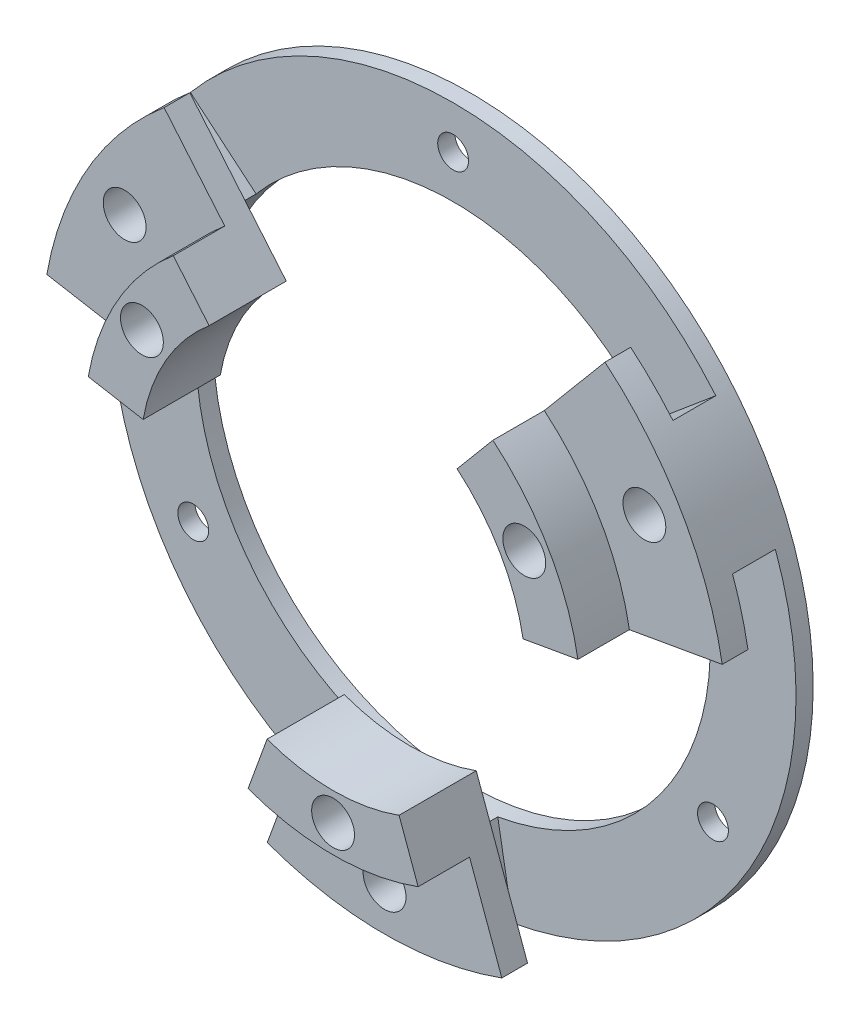
from build123d import *
from build123d.topology import SkipClean

# Parameters (mm, degrees)
SKETCH_1_R          = 40
SKETCH_1_R_2        = 30
EXTRUDE_1_DEPTH     = 2
CUT_EXTRUDE_1_REACH = 58.604
SKETCH_2_R          = 1.8
EXTRUDE_3_DEPTH     = 5
EXTRUDE_4_DEPTH     = 3
CUT_EXTRUDE_2_REACH = 59.446
SKETCH_5_R          = 2.5
EXTRUDE_START       = -3
EXTRUDE_5_DEPTH     = 9
CUT_EXTRUDE_START   = -6
CUT_EXTRUDE_3_DEPTH = 6
CUT_EXTRUDE_4_REACH = 60.788
SKETCH_8_R          = 2.5


with BuildPart() as part:
    # 草图1 → 凸台-拉伸1 (new body)
    with BuildSketch(Plane.XY):
        Circle(SKETCH_1_R)
        Circle(SKETCH_1_R_2, mode=Mode.SUBTRACT)
    extrude(amount=EXTRUDE_1_DEPTH)

    # 草图2 → 切除-拉伸1 (cut, up to next)
    with BuildSketch(Plane.XY.offset(2), mode=Mode.PRIVATE) as cut_extrude_1_sk1:
        with Locations((0, 35)):
            Circle(SKETCH_2_R)
    cut_extrude_1_tool1 = extrude(cut_extrude_1_sk1.sketch, amount=-CUT_EXTRUDE_1_REACH, mode=Mode.PRIVATE) & part.part
    # 草图2 → 切除-拉伸1 (cut, up to next)
    with BuildSketch(Plane.XY.offset(2), mode=Mode.PRIVATE) as cut_extrude_1_sk2:
        with Locations((30.310889132, -17.5)):
            Circle(SKETCH_2_R)
    cut_extrude_1_tool2 = extrude(cut_extrude_1_sk2.sketch, amount=-CUT_EXTRUDE_1_REACH, mode=Mode.PRIVATE) & part.part
    # 草图2 → 切除-拉伸1 (cut, up to next)
    with BuildSketch(Plane.XY.offset(2), mode=Mode.PRIVATE) as cut_extrude_1_sk3:
        with Locations((-30.310889132, -17.5)):
            Circle(SKETCH_2_R)
    cut_extrude_1_tool3 = extrude(cut_extrude_1_sk3.sketch, amount=-CUT_EXTRUDE_1_REACH, mode=Mode.PRIVATE) & part.part
    add(cut_extrude_1_tool1.solids().sort_by_distance((0, 35, 2))[0], mode=Mode.SUBTRACT)
    add(cut_extrude_1_tool2.solids().sort_by_distance((30.310889, -17.5, 2))[0], mode=Mode.SUBTRACT)
    add(cut_extrude_1_tool3.solids().sort_by_distance((-30.310889, -17.5, 2))[0], mode=Mode.SUBTRACT)

    # 草图3 → 凸台-拉伸3 (add)
    with BuildSketch(Plane.XY.offset(2)):
        with BuildLine():
            Line((30.641777725, 25.711504387), (22.981333294, 19.283628291))
            ThreePointArc((22.981333294, 19.283628291), (25.980762114, 15), (28.190778624, 10.2606043))
            Line((28.190778624, 10.2606043), (37.587704831, 13.680805733))
            ThreePointArc((37.587704831, 13.680805733), (34.641016151, 20), (30.641777725, 25.711504387))
        make_face()
        with BuildLine():
            ThreePointArc((-28.190778624, 10.2606043), (-25.980762114, 15), (-22.981333294, 19.283628291))
            Line((-22.981333294, 19.283628291), (-30.641777725, 25.711504387))
            ThreePointArc((-30.641777725, 25.711504387), (-34.641016151, 20), (-37.587704831, 13.680805733))
            Line((-37.587704831, 13.680805733), (-28.190778624, 10.2606043))
        make_face()
        with BuildLine():
            Line((6.945927107, -39.39231012), (5.20944533, -29.54423259))
            ThreePointArc((5.20944533, -29.54423259), (0, -30), (-5.20944533, -29.54423259))
            Line((-5.20944533, -29.54423259), (-6.945927107, -39.39231012))
            ThreePointArc((-6.945927107, -39.39231012), (0, -40), (6.945927107, -39.39231012))
        make_face()
    extrude(amount=EXTRUDE_3_DEPTH)

    # 草图4 → 凸台-拉伸4 (add)
    with BuildSketch(Plane.XY.offset(7)):
        with BuildLine():
            ThreePointArc((-22.981333294, 19.283628291), (-21.213203436, 21.213203436), (-19.283628291, 22.981333294))
            Line((-19.283628291, 22.981333294), (-25.711504387, 30.641777725))
            ThreePointArc((-25.711504387, 30.641777725), (-28.284271247, 28.284271247), (-30.641777725, 25.711504387))
            Line((-30.641777725, 25.711504387), (-22.981333294, 19.283628291))
        make_face()
        with BuildLine():
            ThreePointArc((-25.980762114, 15), (-24.574561329, 17.207293091), (-22.981333294, 19.283628291))
            Line((-22.981333294, 19.283628291), (-30.641777725, 25.711504387))
            ThreePointArc((-30.641777725, 25.711504387), (-32.766081772, 22.943057454), (-34.641016151, 20))
            Line((-34.641016151, 20), (-25.980762114, 15))
        make_face()
        with BuildLine():
            ThreePointArc((-28.190778624, 10.2606043), (-27.189233611, 12.678547852), (-25.980762114, 15))
            Line((-25.980762114, 15), (-34.641016151, 20))
            ThreePointArc((-34.641016151, 20), (-36.252311481, 16.90473047), (-37.587704831, 13.680805733))
            Line((-37.587704831, 13.680805733), (-28.190778624, 10.2606043))
        make_face()
        with BuildLine():
            ThreePointArc((-29.54423259, 5.20944533), (-28.977774789, 7.764571353), (-28.190778624, 10.2606043))
            Line((-28.190778624, 10.2606043), (-37.587704831, 13.680805733))
            ThreePointArc((-37.587704831, 13.680805733), (-38.637033052, 10.352761804), (-39.39231012, 6.945927107))
            Line((-39.39231012, 6.945927107), (-29.54423259, 5.20944533))
        make_face()
        with BuildLine():
            Line((25.711504387, 30.641777725), (19.283628291, 22.981333294))
            ThreePointArc((19.283628291, 22.981333294), (21.213203436, 21.213203436), (22.981333294, 19.283628291))
            ThreePointArc((22.981333294, 19.283628291), (25.980762114, 15), (28.190778624, 10.2606043))
            ThreePointArc((28.190778624, 10.2606043), (28.977774789, 7.764571353), (29.54423259, 5.20944533))
            Line((29.54423259, 5.20944533), (39.39231012, 6.945927107))
            ThreePointArc((39.39231012, 6.945927107), (38.637033052, 10.352761804), (37.587704831, 13.680805733))
            ThreePointArc((37.587704831, 13.680805733), (34.641016151, 20), (30.641777725, 25.711504387))
            ThreePointArc((30.641777725, 25.711504387), (28.284271247, 28.284271247), (25.711504387, 30.641777725))
        make_face()
        with BuildLine():
            ThreePointArc((-5.20944533, -29.54423259), (-7.764571353, -28.977774789), (-10.2606043, -28.190778624))
            Line((-10.2606043, -28.190778624), (-13.680805733, -37.587704831))
            ThreePointArc((-13.680805733, -37.587704831), (-10.352761804, -38.637033052), (-6.945927107, -39.39231012))
            ThreePointArc((-6.945927107, -39.39231012), (0, -40), (6.945927107, -39.39231012))
            ThreePointArc((6.945927107, -39.39231012), (10.352761804, -38.637033052), (13.680805733, -37.587704831))
            Line((13.680805733, -37.587704831), (10.2606043, -28.190778624))
            ThreePointArc((10.2606043, -28.190778624), (7.764571353, -28.977774789), (5.20944533, -29.54423259))
            ThreePointArc((5.20944533, -29.54423259), (0, -30), (-5.20944533, -29.54423259))
        make_face()
    extrude(amount=EXTRUDE_4_DEPTH)

    # 草图5 → 切除-拉伸2 (cut, up to next)
    with BuildSketch(Plane.XY.offset(10), mode=Mode.PRIVATE) as cut_extrude_2_sk1:
        with Locations((-30.310889132, 17.5)):
            Circle(SKETCH_5_R)
    cut_extrude_2_tool1 = extrude(cut_extrude_2_sk1.sketch, amount=-CUT_EXTRUDE_2_REACH, mode=Mode.PRIVATE) & part.part
    # 草图5 → 切除-拉伸2 (cut, up to next)
    with BuildSketch(Plane.XY.offset(10), mode=Mode.PRIVATE) as cut_extrude_2_sk2:
        with Locations((30.310889132, 17.5)):
            Circle(SKETCH_5_R)
    cut_extrude_2_tool2 = extrude(cut_extrude_2_sk2.sketch, amount=-CUT_EXTRUDE_2_REACH, mode=Mode.PRIVATE) & part.part
    # 草图5 → 切除-拉伸2 (cut, up to next)
    with BuildSketch(Plane.XY.offset(10), mode=Mode.PRIVATE) as cut_extrude_2_sk3:
        with Locations((0, -35)):
            Circle(SKETCH_5_R)
    cut_extrude_2_tool3 = extrude(cut_extrude_2_sk3.sketch, amount=-CUT_EXTRUDE_2_REACH, mode=Mode.PRIVATE) & part.part
    add(cut_extrude_2_tool1.solids().sort_by_distance((-30.310889, 17.5, 10))[0], mode=Mode.SUBTRACT)
    add(cut_extrude_2_tool2.solids().sort_by_distance((30.310889, 17.5, 10))[0], mode=Mode.SUBTRACT)
    add(cut_extrude_2_tool3.solids().sort_by_distance((0, -35, 10))[0], mode=Mode.SUBTRACT)

    # 草图6 → 凸台-拉伸5 (add)
    with SkipClean():  # the faces are left unmerged after this step: merging them gives an invalid solid
        with BuildSketch(Plane.XY.offset(10).offset(EXTRUDE_START)):
            with BuildLine():
                Line((-14.462721218, 17.23599997), (-19.283628291, 22.981333294))
                ThreePointArc((-19.283628291, 22.981333294), (-25.980762114, 15), (-29.54423259, 5.20944533))
                Line((-29.54423259, 5.20944533), (-22.158174443, 3.907083998))
                ThreePointArc((-22.158174443, 3.907083998), (-19.485571585, 11.25), (-14.462721218, 17.23599997))
            make_face()
            with BuildLine():
                Line((22.158174443, 3.907083998), (29.54423259, 5.20944533))
                ThreePointArc((29.54423259, 5.20944533), (25.980762114, 15), (19.283628291, 22.981333294))
                Line((19.283628291, 22.981333294), (14.462721218, 17.23599997))
                ThreePointArc((14.462721218, 17.23599997), (19.485571585, 11.25), (22.158174443, 3.907083998))
            make_face()
            with BuildLine():
                Line((-7.695453225, -21.143083968), (-10.2606043, -28.190778624))
                ThreePointArc((-10.2606043, -28.190778624), (0, -30), (10.2606043, -28.190778624))
                Line((10.2606043, -28.190778624), (7.695453225, -21.143083968))
                ThreePointArc((7.695453225, -21.143083968), (0, -22.5), (-7.695453225, -21.143083968))
            make_face()
        extrude(amount=EXTRUDE_5_DEPTH)

    # 草图7 → 切除-拉伸3 (cut)
    with SkipClean():  # the faces are left unmerged after this step: merging them gives an invalid solid
        with BuildSketch(Plane.XY.offset(16).offset(CUT_EXTRUDE_START)):
            with BuildLine():
                Line((-29.54423259, 5.20944533), (-28.559424837, 5.035797152))
                ThreePointArc((-28.559424837, 5.035797152), (-25.11473671, 14.5), (-18.640840681, 22.21528885))
                Line((-18.640840681, 22.21528885), (-19.283628291, 22.981333294))
                ThreePointArc((-19.283628291, 22.981333294), (-25.980762114, 15), (-29.54423259, 5.20944533))
            make_face()
            with BuildLine():
                ThreePointArc((18.640840681, 22.21528885), (25.11473671, 14.5), (28.559424837, 5.035797152))
                Line((28.559424837, 5.035797152), (29.54423259, 5.20944533))
                ThreePointArc((29.54423259, 5.20944533), (25.980762114, 15), (19.283628291, 22.981333294))
                Line((19.283628291, 22.981333294), (18.640840681, 22.21528885))
            make_face()
            with BuildLine():
                ThreePointArc((-10.2606043, -28.190778624), (0, -30), (10.2606043, -28.190778624))
                Line((10.2606043, -28.190778624), (9.918584156, -27.251086003))
                ThreePointArc((9.918584156, -27.251086003), (0, -29), (-9.918584156, -27.251086003))
                Line((-9.918584156, -27.251086003), (-10.2606043, -28.190778624))
            make_face()
        extrude(amount=CUT_EXTRUDE_3_DEPTH, mode=Mode.SUBTRACT)

    # 草图8 → 切除-拉伸4 (cut, up to next)
    with BuildSketch(Plane.XY.offset(16), mode=Mode.PRIVATE) as cut_extrude_4_sk1:
        with Locations((0, -25.75)):
            Circle(SKETCH_8_R)
    cut_extrude_4_tool1 = extrude(cut_extrude_4_sk1.sketch, amount=-CUT_EXTRUDE_4_REACH, mode=Mode.PRIVATE) & part.part
    # 草图8 → 切除-拉伸4 (cut, up to next)
    with BuildSketch(Plane.XY.offset(16), mode=Mode.PRIVATE) as cut_extrude_4_sk2:
        with Locations((22.300154147, 12.875)):
            Circle(SKETCH_8_R)
    cut_extrude_4_tool2 = extrude(cut_extrude_4_sk2.sketch, amount=-CUT_EXTRUDE_4_REACH, mode=Mode.PRIVATE) & part.part
    # 草图8 → 切除-拉伸4 (cut, up to next)
    with BuildSketch(Plane.XY.offset(16), mode=Mode.PRIVATE) as cut_extrude_4_sk3:
        with BuildLine():
            ThreePointArc((-24.465217657, 14.125), (-23.550154147, 10.709936491), (-20.135090638, 11.625))
            Line((-20.135090638, 11.625), (-24.465217657, 14.125))
        make_face()
    cut_extrude_4_tool3 = extrude(cut_extrude_4_sk3.sketch, amount=-CUT_EXTRUDE_4_REACH, mode=Mode.PRIVATE) & part.part
    # 草图8 → 切除-拉伸4 (cut, up to next)
    with BuildSketch(Plane.XY.offset(16), mode=Mode.PRIVATE) as cut_extrude_4_sk4:
        with BuildLine():
            Line((-24.465217657, 14.125), (-20.135090638, 11.625))
            ThreePointArc((-20.135090638, 11.625), (-19.885339582, 12.227952387), (-19.800154147, 12.875))
            ThreePointArc((-19.800154147, 12.875), (-21.653106535, 15.289814566), (-24.465217657, 14.125))
        make_face()
    cut_extrude_4_tool4 = extrude(cut_extrude_4_sk4.sketch, amount=-CUT_EXTRUDE_4_REACH, mode=Mode.PRIVATE) & part.part
    # 草图8 → 切除-拉伸4 (cut, up to next)
    with BuildSketch(Plane.XY.offset(16), mode=Mode.PRIVATE) as cut_extrude_4_sk5:
        with BuildLine():
            ThreePointArc((-24.465217657, 14.125), (-23.550154147, 10.709936491), (-20.135090638, 11.625))
            Line((-20.135090638, 11.625), (-24.465217657, 14.125))
        make_face()
    cut_extrude_4_tool5 = extrude(cut_extrude_4_sk5.sketch, amount=-CUT_EXTRUDE_4_REACH, mode=Mode.PRIVATE) & part.part
    # 草图8 → 切除-拉伸4 (cut, up to next)
    with BuildSketch(Plane.XY.offset(16), mode=Mode.PRIVATE) as cut_extrude_4_sk6:
        with BuildLine():
            Line((-24.465217657, 14.125), (-20.135090638, 11.625))
            ThreePointArc((-20.135090638, 11.625), (-19.885339582, 12.227952387), (-19.800154147, 12.875))
            ThreePointArc((-19.800154147, 12.875), (-21.653106535, 15.289814566), (-24.465217657, 14.125))
        make_face()
    cut_extrude_4_tool6 = extrude(cut_extrude_4_sk6.sketch, amount=-CUT_EXTRUDE_4_REACH, mode=Mode.PRIVATE) & part.part
    add(cut_extrude_4_tool1.solids().sort_by_distance((0, -25.75, 16))[0], mode=Mode.SUBTRACT)
    add(cut_extrude_4_tool2.solids().sort_by_distance((22.300154, 12.875, 16))[0], mode=Mode.SUBTRACT)
    add(cut_extrude_4_tool3.solids().sort_by_distance((-22.830671, 11.956119, 16))[0], mode=Mode.SUBTRACT)
    add(cut_extrude_4_tool4.solids().sort_by_distance((-21.769638, 13.793881, 16))[0], mode=Mode.SUBTRACT)
    add(cut_extrude_4_tool5.solids().sort_by_distance((-22.830671, 11.956119, 16))[0], mode=Mode.SUBTRACT)
    add(cut_extrude_4_tool6.solids().sort_by_distance((-21.769638, 13.793881, 16))[0], mode=Mode.SUBTRACT)


solid = part.part
